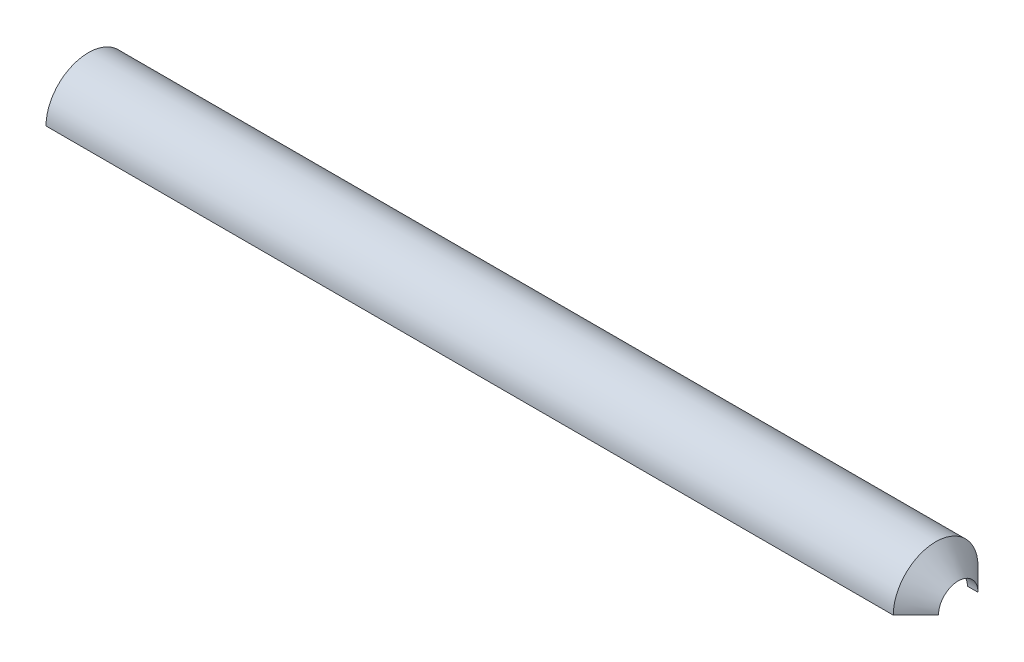
from build123d import *

# Parameters (mm, degrees)
BOSS_EXTRUDE1_DEPTH = 60
BOSS_EXTRUDE2_START = -5
BOSS_EXTRUDE2_DEPTH = 5
REVOLVE1_ANGLE      = 180


with BuildPart() as part:
    # Sketch1 → Boss-Extrude1 (new, symmetric)
    with BuildSketch(Plane(origin=(0, 0, 0), x_dir=(0, 0, -1), z_dir=(1, 0, 0))):
        with BuildLine():
            Line((-6, 0), (-4.5, 0))
            ThreePointArc((-4.5, 0), (0, 4.5), (4.5, 0))
            Line((4.5, 0), (6, 0))
            ThreePointArc((6, 0), (0, 6), (-6, 0))
        make_face()
    extrude(amount=BOSS_EXTRUDE1_DEPTH, both=True)

    # Sketch2 → Boss-Extrude2 (add)
    with BuildSketch(Plane.ZY.offset(60).offset(BOSS_EXTRUDE2_START)):
        with BuildLine():
            Line((-4.5, 0), (4.5, 0))
            ThreePointArc((4.5, 0), (0, 4.5), (-4.5, 0))
        make_face()
    extrude(amount=BOSS_EXTRUDE2_DEPTH)

    # Sketch3 → Revolve1 (revolve)
    with BuildSketch(Plane.XZ):
        Polygon((60, 6), (63.2, 2.8), (61.7, 2.8), (60, 4.5), align=None)
    revolve(axis=Axis((0, 0, 0), (-1, 0, 0)), revolution_arc=REVOLVE1_ANGLE)


solid = part.part
